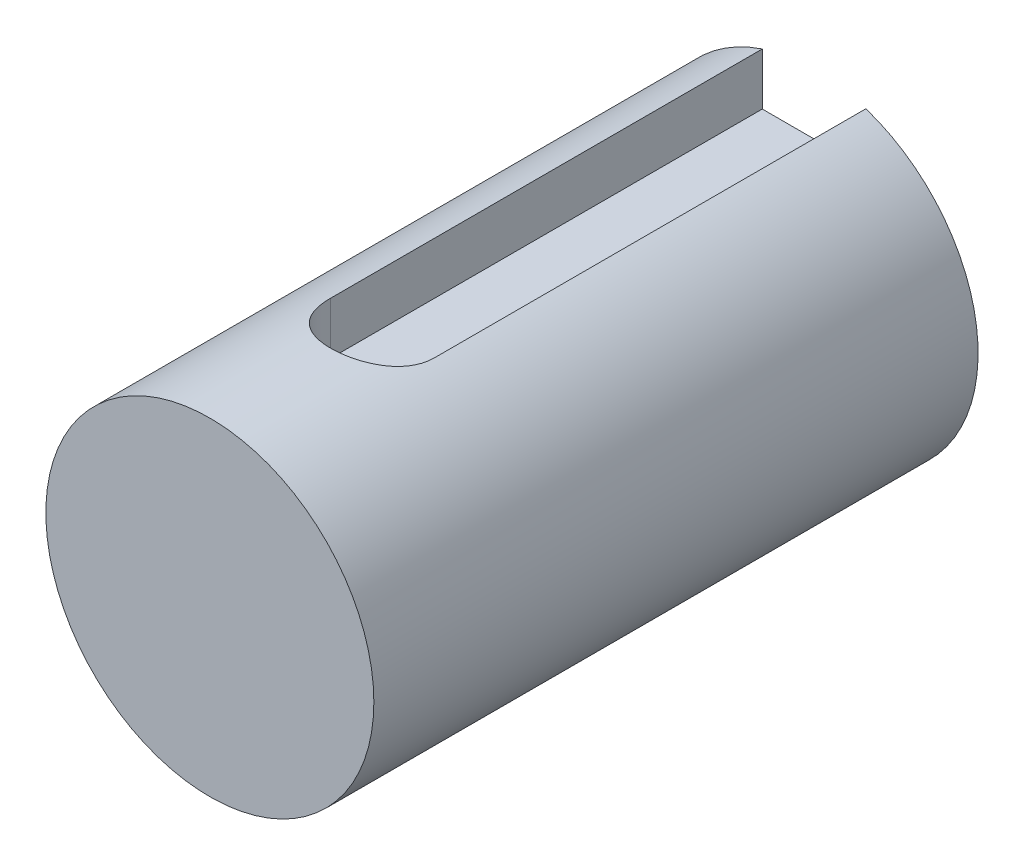
from build123d import *

# Parameters (mm, degrees)
SKETCH1_R           = 9.5
BOSS_EXTRUDE1_DEPTH = 35
CUT_EXTRUDE1_DEPTH  = 4


with BuildPart() as part:
    # Sketch1 → Boss-Extrude1 (new body)
    with BuildSketch(Plane.XY):
        Circle(SKETCH1_R)
    extrude(amount=BOSS_EXTRUDE1_DEPTH)

    # Sketch4 → Cut-Extrude1 (cut)
    with BuildSketch(Plane(origin=(0, 10, 0), x_dir=(1, 0, 0), z_dir=(0, 1, 0))):
        with BuildLine():
            Line((3, 0), (3, -25))
            ThreePointArc((3, -25), (0, -28), (-3, -25))
            Line((-3, -25), (-3, 0))
            Line((-3, 0), (3, 0))
        make_face()
    extrude(amount=-CUT_EXTRUDE1_DEPTH, mode=Mode.SUBTRACT)


solid = part.part
